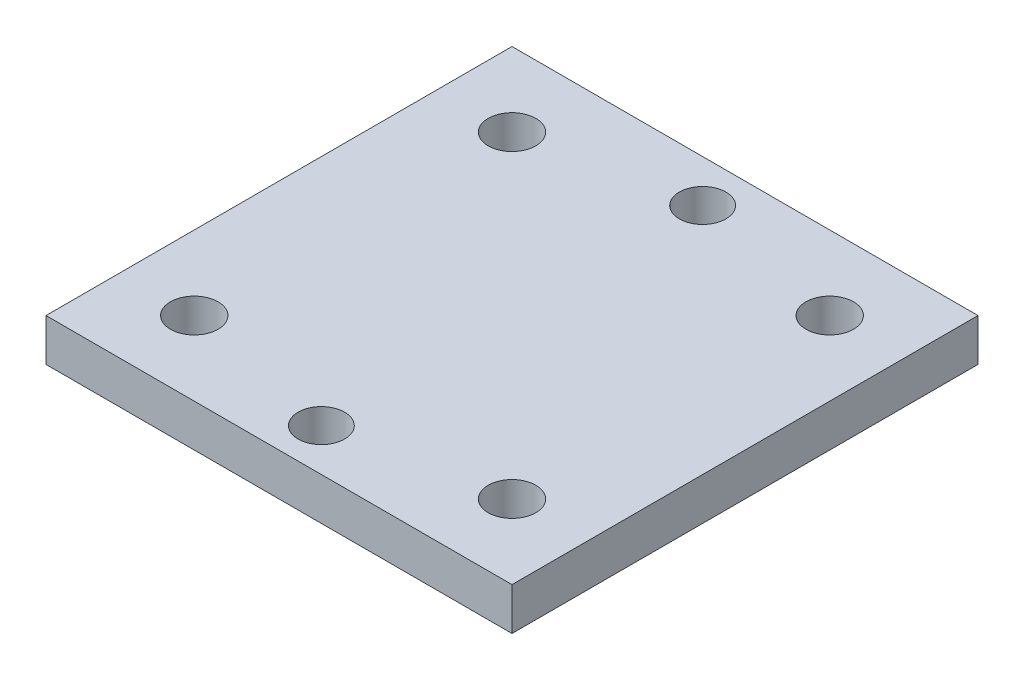
from build123d import *

# Parameters (mm, degrees)
SK_PLATE_W      = 44
SK_PLATE_H      = 44
EX_PLATE_DEPTH  = 4
SK_HOLES_R      = 2.25
SK_HOLES_R_2    = 2.2
CUT_HOLES_DEPTH = 4


with BuildPart() as part:
    # SK_Plate → EX_Plate (new body)
    with BuildSketch(Plane(origin=(0, 0, 0), x_dir=(1, 0, 0), z_dir=(0, 1, 0))):
        Rectangle(SK_PLATE_W, SK_PLATE_H)
    extrude(amount=EX_PLATE_DEPTH)

    # SK_Holes → CUT_Holes (cut)
    with BuildSketch(Plane(origin=(0, 0, 0), x_dir=(1, 0, 0), z_dir=(0, 1, 0))):
        with Locations((15, -15)):
            Circle(SK_HOLES_R)
        with Locations((-15, -15)):
            Circle(SK_HOLES_R)
        with Locations((15, 15)):
            Circle(SK_HOLES_R)
        with Locations((-15, 15)):
            Circle(SK_HOLES_R)
        with Locations((0, -18)):
            Circle(SK_HOLES_R_2)
        with Locations((0, 18)):
            Circle(SK_HOLES_R_2)
    extrude(amount=CUT_HOLES_DEPTH, mode=Mode.SUBTRACT)


solid = part.part
